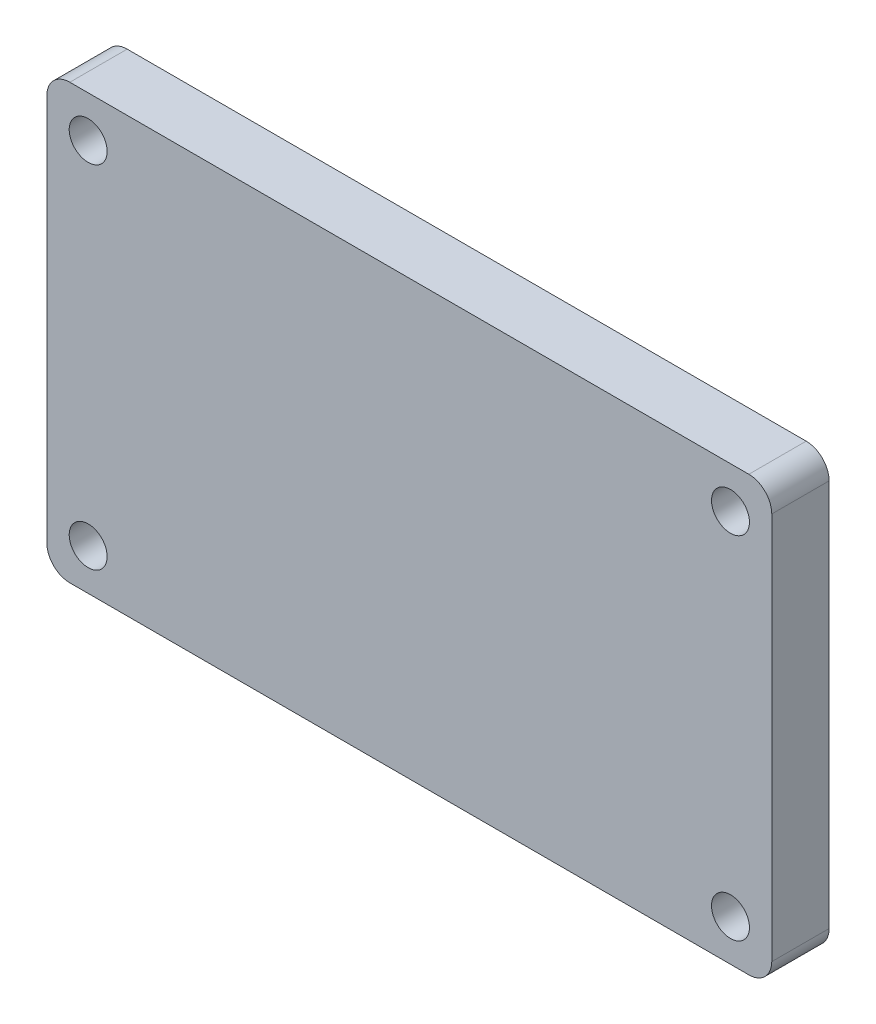
from build123d import *

# Parameters (mm, degrees)
SKETCH1_W           = 80.264
SKETCH1_H           = 48.006
SKETCH1_W_2         = 71.12
SKETCH1_H_2         = 38.862
BOSS_EXTRUDE1_DEPTH = 6.35
CUT_EXTRUDE2_DEPTH  = 48.191566333
FILLET1_R           = 2.54


with BuildPart() as part:
    # Sketch1 → Boss-Extrude1 (new body)
    # profile 1 of 2: a face of its own
    with BuildSketch(Plane.XY):
        Rectangle(SKETCH1_W, SKETCH1_H)
        Rectangle(SKETCH1_W_2, SKETCH1_H_2, mode=Mode.SUBTRACT)
    # profile 2 of 2: a face of its own
    with BuildSketch(Plane.XY):
        Rectangle(SKETCH1_W_2, SKETCH1_H_2)
    extrude(amount=BOSS_EXTRUDE1_DEPTH)

    # Sketch2 → Cut-Extrude2 (cut, through all)
    with BuildSketch(Plane.XY.offset(6.35)):
        with BuildLine():
            ThreePointArc((-33.459999882, 19.431), (-37.044924324, 20.915924324), (-35.56, 17.330999882))
            Line((-35.56, 17.330999882), (-35.56, 19.431))
            Line((-35.56, 19.431), (-33.459999882, 19.431))
        make_face()
        with BuildLine():
            Line((-35.56, 19.431), (-35.56, 17.330999882))
            ThreePointArc((-35.56, 17.330999882), (-34.075075676, 17.946075676), (-33.459999882, 19.431))
            Line((-33.459999882, 19.431), (-35.56, 19.431))
        make_face()
        with BuildLine():
            Line((-35.56, -17.330999882), (-35.56, -19.431))
            Line((-35.56, -19.431), (-33.459999882, -19.431))
            ThreePointArc((-33.459999882, -19.431), (-34.075075676, -17.946075676), (-35.56, -17.330999882))
        make_face()
        with BuildLine():
            Line((-33.459999882, -19.431), (-35.56, -19.431))
            Line((-35.56, -19.431), (-35.56, -17.330999882))
            ThreePointArc((-35.56, -17.330999882), (-37.044924324, -20.915924324), (-33.459999882, -19.431))
        make_face()
        with BuildLine():
            ThreePointArc((33.459999882, 19.431), (34.075075676, 17.946075676), (35.56, 17.330999882))
            Line((35.56, 17.330999882), (35.56, 19.431))
            Line((35.56, 19.431), (33.459999882, 19.431))
        make_face()
        with BuildLine():
            Line((35.56, 19.431), (35.56, 17.330999882))
            ThreePointArc((35.56, 17.330999882), (37.044924324, 17.946075676), (37.660000118, 19.431))
            ThreePointArc((37.660000118, 19.431), (35.56, 21.531000118), (33.459999882, 19.431))
            Line((33.459999882, 19.431), (35.56, 19.431))
        make_face()
        with BuildLine():
            ThreePointArc((35.56, -17.330999882), (34.075075676, -17.946075676), (33.459999882, -19.431))
            Line((33.459999882, -19.431), (35.56, -19.431))
            Line((35.56, -19.431), (35.56, -17.330999882))
        make_face()
        with BuildLine():
            Line((35.56, -19.431), (33.459999882, -19.431))
            ThreePointArc((33.459999882, -19.431), (35.56, -21.531000118), (37.660000118, -19.431))
            ThreePointArc((37.660000118, -19.431), (37.044924324, -17.946075676), (35.56, -17.330999882))
            Line((35.56, -17.330999882), (35.56, -19.431))
        make_face()
    extrude(amount=-CUT_EXTRUDE2_DEPTH, mode=Mode.SUBTRACT)

    # Fillet1
    fillet1_edges = [part.edges().sort_by_distance(p)[0] for p in [
        (-40.132, -24.003, 3.175),
        (-40.132, 24.003, 3.175),
        (40.132, 24.003, 3.175),
        (40.132, -24.003, 3.175),
    ]]
    fillet(fillet1_edges, radius=FILLET1_R)


solid = part.part
